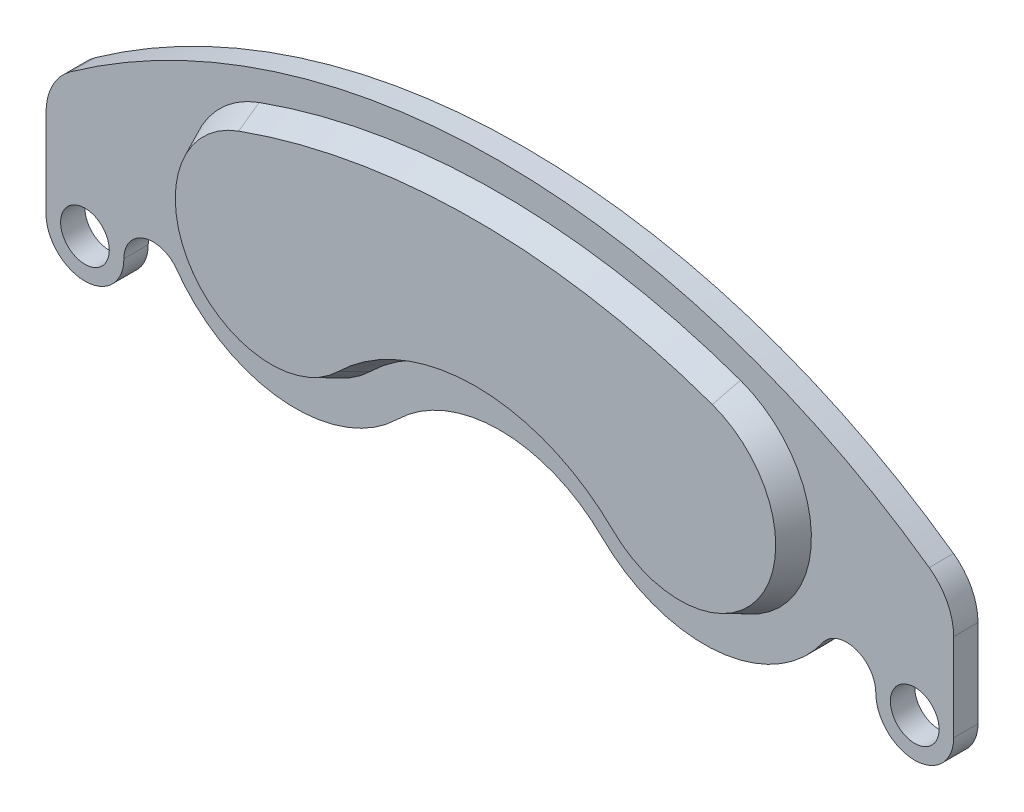
from build123d import *

# Parameters (mm, degrees)
BOSS_EXTRUDE1_DEPTH = 1.25
BOSS_EXTRUDE2_DEPTH = 2.5
BOSS_EXTRUDE2_TAPER = 25
SKETCH3_R           = 2.5
CUT_EXTRUDE1_DEPTH  = 90.193531509


with BuildPart() as part:
    # Sketch1 → Boss-Extrude1 (new, symmetric)
    with BuildSketch(Plane.XY):
        with BuildLine():
            Line((-46.61798004, 57.010347284), (-46.61798004, 48.010347284))
            ThreePointArc((-46.61798004, 48.010347284), (-42.61798004, 44.010347284), (-38.61798004, 48.010347284))
            ThreePointArc((-38.61798004, 48.010347284), (-36.630320397, 50.834381101), (-33.301202039, 49.916269553))
            ThreePointArc((-33.301202039, 49.916269553), (-22.394136584, 43.564927748), (-10.5, 47.787857357))
            ThreePointArc((-10.5, 47.787857357), (0, 52.075714714), (10.5, 47.787857357))
            ThreePointArc((10.5, 47.787857357), (22.394136584, 43.564927748), (33.301202039, 49.916269553))
            ThreePointArc((33.301202039, 49.916269553), (36.630320397, 50.834381101), (38.61798004, 48.010347284))
            ThreePointArc((38.61798004, 48.010347284), (42.61798004, 44.010347284), (46.61798004, 48.010347284))
            Line((46.61798004, 48.010347284), (46.61798004, 57.010347284))
            ThreePointArc((46.61798004, 57.010347284), (45.951330154, 59.759051808), (44.099521187, 61.89694848))
            ThreePointArc((44.099521187, 61.89694848), (0, 76), (-44.099521187, 61.89694848))
            ThreePointArc((-44.099521187, 61.89694848), (-45.951330154, 59.759051808), (-46.61798004, 57.010347284))
        make_face()
    extrude(amount=BOSS_EXTRUDE1_DEPTH, both=True)

    # Sketch2 → Boss-Extrude2 (add)
    with BuildSketch(Plane.XY.offset(1.25)):
        with BuildLine():
            ThreePointArc((24.718185374, 68.857802113), (0, 73.16), (-24.718185374, 68.857802113))
            ThreePointArc((-24.718185374, 68.857802113), (-30.323870792, 52.65411251), (-13.296533646, 50.64089234))
            ThreePointArc((-13.296533646, 50.64089234), (0, 56.07076278), (13.296533646, 50.64089234))
            ThreePointArc((13.296533646, 50.64089234), (30.323870792, 52.65411251), (24.718185374, 68.857802113))
        make_face()
    extrude(amount=BOSS_EXTRUDE2_DEPTH, taper=BOSS_EXTRUDE2_TAPER)

    # Sketch3 → Cut-Extrude1 (cut, through all)
    with BuildSketch(Plane.XY.offset(1.25)):
        with Locations((-42.61798004, 48.010347284)):
            Circle(SKETCH3_R)
        with Locations((42.61798004, 48.010347284)):
            Circle(SKETCH3_R)
    extrude(amount=-CUT_EXTRUDE1_DEPTH, mode=Mode.SUBTRACT)


solid = part.part
